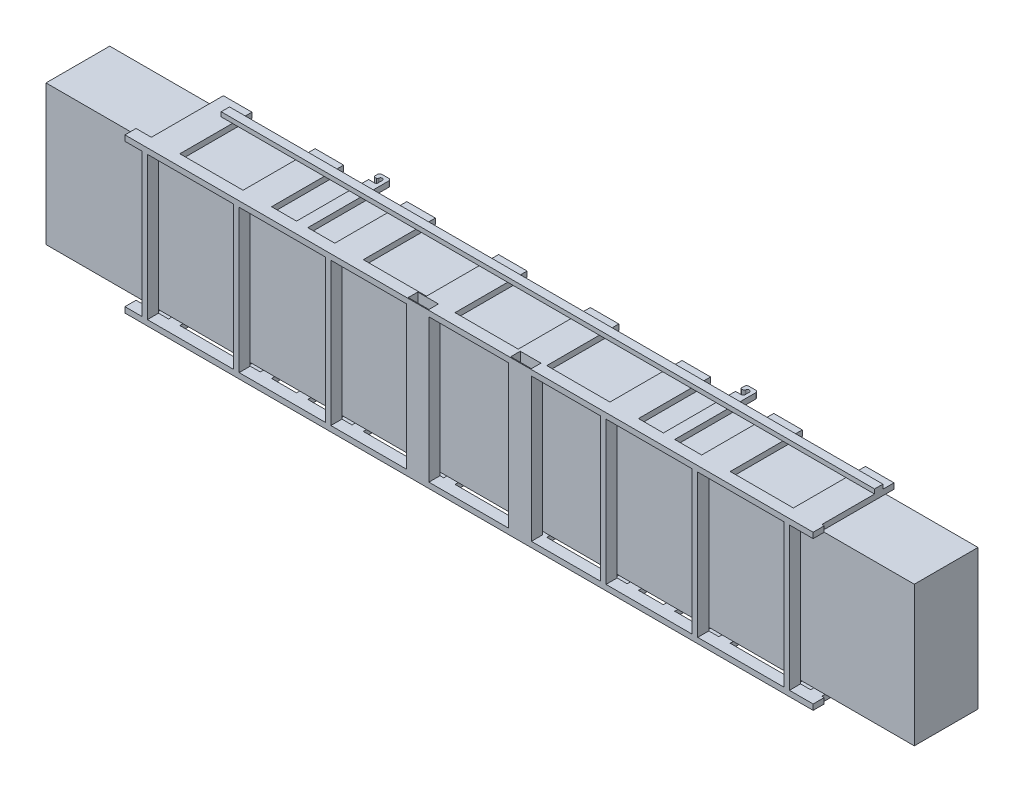
from build123d import *

# Parameters (mm, degrees)
SKETCH1_W             = 6190
SKETCH1_H             = 50
BOSS_EXTRUDE1_DEPTH   = 100
BOSS_EXTRUDE1_2_DEPTH = 100
SKETCH2_W             = 200
SKETCH2_H             = 100
BOSS_EXTRUDE2_DEPTH   = 1388
SKETCH3_W             = 186
SKETCH3_H             = 86
CUT_EXTRUDE1_DEPTH    = 6345.497143194
BOSS_EXTRUDE3_REACH   = 6335.746
SKETCH4_W             = 50
SKETCH4_H             = 100
SKETCH4_W_2           = 4
BOSS_EXTRUDE4_DEPTH   = 648.4
BOSS_EXTRUDE5_DEPTH   = 50
BOSS_EXTRUDE6_DEPTH   = 50
BOSS_EXTRUDE7_REACH   = 6369.355
SKETCH10_W            = 75
SKETCH10_H            = 40
SKETCH11_W            = 572.975396728
SKETCH11_H            = 1259.313187421
BOSS_EXTRUDE10_DEPTH  = 7000
SKETCH12_W            = 572.975396728
SKETCH12_H            = 1259.313187421
BOSS_EXTRUDE11_DEPTH  = 810


with BuildPart() as part:
    # Sketch1 → Boss-Extrude1 (new body)
    with BuildSketch(Plane.XY):
        with Locations((3095, 1363)):
            Rectangle(SKETCH1_W, SKETCH1_H)
    extrude(amount=BOSS_EXTRUDE1_DEPTH)



with BuildPart() as body_2:
    # Sketch1 → Boss-Extrude1 2 (new body)
    with BuildSketch(Plane.XY):
        with Locations((3095, 25)):
            Rectangle(SKETCH1_W, SKETCH1_H)
    extrude(amount=BOSS_EXTRUDE1_2_DEPTH)


with BuildPart() as part_1:
    add(part.part)

    add(body_2.part)  # Boss-Extrude2 merges body 2
    # Sketch2 → Boss-Extrude2 (add)
    with BuildSketch(Plane.XZ):
        with Locations((2634, 50)):
            Rectangle(SKETCH2_W, SKETCH2_H)
        with Locations((3556, 50)):
            Rectangle(SKETCH2_W, SKETCH2_H)
    extrude(amount=-BOSS_EXTRUDE2_DEPTH)

    # Sketch3 → Cut-Extrude1 (cut, through all)
    with BuildSketch(Plane(origin=(0, 1388, 0), x_dir=(1, 0, 0), z_dir=(0, 1, 0))):
        with Locations((2634, -50)):
            Rectangle(SKETCH3_W, SKETCH3_H)
        with Locations((3556, -50)):
            Rectangle(SKETCH3_W, SKETCH3_H)
    extrude(amount=-CUT_EXTRUDE1_DEPTH, mode=Mode.SUBTRACT)

    # Sketch4 → Boss-Extrude3 (add, up to next)
    with BuildSketch(Plane(origin=(0, 50, 0), x_dir=(1, 0, 0), z_dir=(0, 1, 0)), mode=Mode.PRIVATE) as boss_extrude3_sk1:
        with Locations((177, -50)):
            Rectangle(SKETCH4_W, SKETCH4_H)
    boss_extrude3_tool1 = extrude(boss_extrude3_sk1.sketch, amount=BOSS_EXTRUDE3_REACH, mode=Mode.PRIVATE) - part_1.part
    # Sketch4 → Boss-Extrude3 (add, up to next)
    with BuildSketch(Plane(origin=(0, 50, 0), x_dir=(1, 0, 0), z_dir=(0, 1, 0)), mode=Mode.PRIVATE) as boss_extrude3_sk2:
        with Locations((1002, -50)):
            Rectangle(SKETCH4_W, SKETCH4_H)
    boss_extrude3_tool2 = extrude(boss_extrude3_sk2.sketch, amount=BOSS_EXTRUDE3_REACH, mode=Mode.PRIVATE) - part_1.part
    # Sketch4 → Boss-Extrude3 (add, up to next)
    with BuildSketch(Plane(origin=(0, 50, 0), x_dir=(1, 0, 0), z_dir=(0, 1, 0)), mode=Mode.PRIVATE) as boss_extrude3_sk3:
        with Locations((1827, -50)):
            Rectangle(SKETCH4_W, SKETCH4_H)
    boss_extrude3_tool3 = extrude(boss_extrude3_sk3.sketch, amount=BOSS_EXTRUDE3_REACH, mode=Mode.PRIVATE) - part_1.part
    # Sketch4 → Boss-Extrude3 (add, up to next)
    with BuildSketch(Plane(origin=(0, 50, 0), x_dir=(1, 0, 0), z_dir=(0, 1, 0)), mode=Mode.PRIVATE) as boss_extrude3_sk4:
        with Locations((3454, -50)):
            Rectangle(SKETCH4_W_2, SKETCH4_H)
    boss_extrude3_tool4 = extrude(boss_extrude3_sk4.sketch, amount=BOSS_EXTRUDE3_REACH, mode=Mode.PRIVATE) - part_1.part
    # Sketch4 → Boss-Extrude3 (add, up to next)
    with BuildSketch(Plane(origin=(0, 50, 0), x_dir=(1, 0, 0), z_dir=(0, 1, 0)), mode=Mode.PRIVATE) as boss_extrude3_sk5:
        with Locations((4302, -50)):
            Rectangle(SKETCH4_W, SKETCH4_H)
    boss_extrude3_tool5 = extrude(boss_extrude3_sk5.sketch, amount=BOSS_EXTRUDE3_REACH, mode=Mode.PRIVATE) - part_1.part
    # Sketch4 → Boss-Extrude3 (add, up to next)
    with BuildSketch(Plane(origin=(0, 50, 0), x_dir=(1, 0, 0), z_dir=(0, 1, 0)), mode=Mode.PRIVATE) as boss_extrude3_sk6:
        with Locations((5127, -50)):
            Rectangle(SKETCH4_W, SKETCH4_H)
    boss_extrude3_tool6 = extrude(boss_extrude3_sk6.sketch, amount=BOSS_EXTRUDE3_REACH, mode=Mode.PRIVATE) - part_1.part
    # Sketch4 → Boss-Extrude3 (add, up to next)
    with BuildSketch(Plane(origin=(0, 50, 0), x_dir=(1, 0, 0), z_dir=(0, 1, 0)), mode=Mode.PRIVATE) as boss_extrude3_sk7:
        with Locations((5952, -50)):
            Rectangle(SKETCH4_W, SKETCH4_H)
    boss_extrude3_tool7 = extrude(boss_extrude3_sk7.sketch, amount=BOSS_EXTRUDE3_REACH, mode=Mode.PRIVATE) - part_1.part
    add(boss_extrude3_tool1.solids().sort_by_distance((177, 50, 50))[0])
    add(boss_extrude3_tool2.solids().sort_by_distance((1002, 50, 50))[0])
    add(boss_extrude3_tool3.solids().sort_by_distance((1827, 50, 50))[0])
    add(boss_extrude3_tool4.solids().sort_by_distance((3454, 50, 50))[0])
    add(boss_extrude3_tool5.solids().sort_by_distance((4302, 50, 50))[0])
    add(boss_extrude3_tool6.solids().sort_by_distance((5127, 50, 50))[0])
    add(boss_extrude3_tool7.solids().sort_by_distance((5952, 50, 50))[0])

    # Sketch5 → Boss-Extrude4 (add)
    with BuildSketch(Plane.XY):
        Polygon((137.4, 1388), (137.4, 1338), (140.4, 1338), (140.4, 1385.8), (292.4, 1385.8), (292.4, 1338), (394, 1338), (394, 1388), align=None)
        Polygon((962.4, 1388), (962.4, 1338), (965.4, 1338), (965.4, 1385.8), (1117.4, 1385.8), (1117.4, 1338), (1219, 1338), (1219, 1388), align=None)
        Polygon((1787.4, 1388), (1787.4, 1338), (1790.4, 1338), (1790.4, 1385.8), (1942.4, 1385.8), (1942.4, 1338), (2044, 1338), (2044, 1388), align=None)
        Polygon((2612.4, 1388), (2612.4, 1338), (2615.4, 1338), (2615.4, 1385.8), (2767.4, 1385.8), (2767.4, 1338), (2869, 1338), (2869, 1388), align=None)
        Polygon((3437.4, 1388), (3437.4, 1338), (3440.4, 1338), (3440.4, 1385.8), (3592.4, 1385.8), (3592.4, 1338), (3694, 1338), (3694, 1388), align=None)
        Polygon((4262.4, 1388), (4262.4, 1338), (4265.4, 1338), (4265.4, 1385.8), (4417.4, 1385.8), (4417.4, 1338), (4519, 1338), (4519, 1388), align=None)
        Polygon((5087.4, 1388), (5087.4, 1338), (5090.4, 1338), (5090.4, 1385.8), (5242.4, 1385.8), (5242.4, 1338), (5344, 1338), (5344, 1388), align=None)
        Polygon((5912.4, 1388), (5912.4, 1338), (5915.4, 1338), (5915.4, 1385.8), (6067.4, 1385.8), (6067.4, 1338), (6169, 1338), (6169, 1388), align=None)
        Polygon((6067.4, 2.2), (6067.4, 50), (6169, 50), (6169, 0), (5912.4, 0), (5912.4, 50), (5915.4, 50), (5915.4, 2.2), align=None)
        Polygon((5242.4, 2.2), (5242.4, 50), (5344, 50), (5344, 0), (5087.4, 0), (5087.4, 50), (5090.4, 50), (5090.4, 2.2), align=None)
        Polygon((4417.4, 2.2), (4417.4, 50), (4519, 50), (4519, 0), (4262.4, 0), (4262.4, 50), (4265.4, 50), (4265.4, 2.2), align=None)
        Polygon((3592.4, 2.2), (3592.4, 50), (3694, 50), (3694, 0), (3437.4, 0), (3437.4, 50), (3440.4, 50), (3440.4, 2.2), align=None)
        Polygon((2767.4, 2.2), (2767.4, 50), (2869, 50), (2869, 0), (2612.4, 0), (2612.4, 50), (2615.4, 50), (2615.4, 2.2), align=None)
        Polygon((1942.4, 2.2), (1942.4, 50), (2044, 50), (2044, 0), (1787.4, 0), (1787.4, 50), (1790.4, 50), (1790.4, 2.2), align=None)
        Polygon((1117.4, 2.2), (1117.4, 50), (1219, 50), (1219, 0), (962.4, 0), (962.4, 50), (965.4, 50), (965.4, 2.2), align=None)
        Polygon((292.4, 2.2), (292.4, 50), (394, 50), (394, 0), (137.4, 0), (137.4, 50), (140.4, 50), (140.4, 2.2), align=None)
    extrude(amount=-BOSS_EXTRUDE4_DEPTH)

    # Sketch8 → Boss-Extrude5 (add)
    with BuildSketch(Plane(origin=(0, 50, 0), x_dir=(1, 0, 0), z_dir=(0, 1, 0))):
        with BuildLine():
            Line((1443.4, 648.4), (1497.5, 648.4))
            ThreePointArc((1497.5, 648.4), (1508.106601718, 652.793398282), (1512.5, 663.4))
            Line((1512.5, 663.4), (1512.5, 703.4))
            ThreePointArc((1512.5, 703.4), (1495, 720.9), (1477.5, 703.4))
            ThreePointArc((1477.5, 703.4), (1474.571067812, 696.328932188), (1467.5, 693.4))
            Line((1467.5, 693.4), (1453.4, 693.4))
            ThreePointArc((1453.4, 693.4), (1446.328932188, 696.328932188), (1443.4, 703.4))
            Line((1443.4, 703.4), (1443.4, 728.4))
            ThreePointArc((1443.4, 728.4), (1449.257864376, 742.542135624), (1463.4, 748.4))
            Line((1463.4, 748.4), (1525, 748.4))
            ThreePointArc((1525, 748.4), (1539.142135624, 742.542135624), (1545, 728.4))
            Line((1545, 728.4), (1545, 0))
            Line((1545, 0), (1443.4, 0))
            Line((1443.4, 0), (1443.4, 648.4))
        make_face()
        with BuildLine():
            Line((4845, 0), (4743.4, 0))
            Line((4743.4, 0), (4743.4, 648.4))
            Line((4743.4, 648.4), (4797.5, 648.4))
            ThreePointArc((4797.5, 648.4), (4808.106601718, 652.793398282), (4812.5, 663.4))
            Line((4812.5, 663.4), (4812.5, 703.4))
            ThreePointArc((4812.5, 703.4), (4795, 720.9), (4777.5, 703.4))
            ThreePointArc((4777.5, 703.4), (4774.571067812, 696.328932188), (4767.5, 693.4))
            Line((4767.5, 693.4), (4753.4, 693.4))
            ThreePointArc((4753.4, 693.4), (4746.328932188, 696.328932188), (4743.4, 703.4))
            Line((4743.4, 703.4), (4743.4, 728.4))
            ThreePointArc((4743.4, 728.4), (4749.257864376, 742.542135624), (4763.4, 748.4))
            Line((4763.4, 748.4), (4825, 748.4))
            ThreePointArc((4825, 748.4), (4839.142135624, 742.542135624), (4845, 728.4))
            Line((4845, 728.4), (4845, 0))
        make_face()
    extrude(amount=-BOSS_EXTRUDE5_DEPTH)

    # Sketch9 → Boss-Extrude6 (add)
    with BuildSketch(Plane(origin=(0, 1388, 0), x_dir=(1, 0, 0), z_dir=(0, 1, 0))):
        with BuildLine():
            Line((1443.4, 648.4), (1497.5, 648.4))
            ThreePointArc((1497.5, 648.4), (1508.106601718, 652.793398282), (1512.5, 663.4))
            Line((1512.5, 663.4), (1512.5, 703.4))
            ThreePointArc((1512.5, 703.4), (1495, 720.9), (1477.5, 703.4))
            ThreePointArc((1477.5, 703.4), (1474.571067812, 696.328932188), (1467.5, 693.4))
            Line((1467.5, 693.4), (1453.4, 693.4))
            ThreePointArc((1453.4, 693.4), (1446.328932188, 696.328932188), (1443.4, 703.4))
            Line((1443.4, 703.4), (1443.4, 728.4))
            ThreePointArc((1443.4, 728.4), (1449.257864376, 742.542135624), (1463.4, 748.4))
            Line((1463.4, 748.4), (1525, 748.4))
            ThreePointArc((1525, 748.4), (1539.142135624, 742.542135624), (1545, 728.4))
            Line((1545, 728.4), (1545, 0))
            Line((1545, 0), (1443.4, 0))
            Line((1443.4, 0), (1443.4, 648.4))
        make_face()
        with BuildLine():
            Line((4845, 0), (4743.4, 0))
            Line((4743.4, 0), (4743.4, 648.4))
            Line((4743.4, 648.4), (4797.5, 648.4))
            ThreePointArc((4797.5, 648.4), (4808.106601718, 652.793398282), (4812.5, 663.4))
            Line((4812.5, 663.4), (4812.5, 703.4))
            ThreePointArc((4812.5, 703.4), (4795, 720.9), (4777.5, 703.4))
            ThreePointArc((4777.5, 703.4), (4774.571067812, 696.328932188), (4767.5, 693.4))
            Line((4767.5, 693.4), (4753.4, 693.4))
            ThreePointArc((4753.4, 693.4), (4746.328932188, 696.328932188), (4743.4, 703.4))
            Line((4743.4, 703.4), (4743.4, 728.4))
            ThreePointArc((4743.4, 728.4), (4749.257864376, 742.542135624), (4763.4, 748.4))
            Line((4763.4, 748.4), (4825, 748.4))
            ThreePointArc((4825, 748.4), (4839.142135624, 742.542135624), (4845, 728.4))
            Line((4845, 728.4), (4845, 0))
        make_face()
    extrude(amount=-BOSS_EXTRUDE6_DEPTH)

    # Boss-Extrude7: up to this face of the body (flat: up to its plane)
    boss_extrude7_end = Plane(part_1.part.faces().sort_by_distance((292.4, 1361.9, -324.2))[0])
    # Sketch10 → Boss-Extrude7 (add, up to the picked face)
    with BuildSketch(Plane(origin=(6169, 0, 0), x_dir=(0, 0, -1), z_dir=(1, 0, 0)), mode=Mode.PRIVATE) as boss_extrude7_sk1:
        with Locations((510.9, -20)):
            Rectangle(SKETCH10_W, SKETCH10_H)
    boss_extrude7_tool1 = split(extrude(boss_extrude7_sk1.sketch, amount=-BOSS_EXTRUDE7_REACH, mode=Mode.PRIVATE), bisect_by=boss_extrude7_end, keep=Keep.BOTH, mode=Mode.PRIVATE)
    # Sketch10 → Boss-Extrude7 (add, up to the picked face)
    with BuildSketch(Plane(origin=(6169, 0, 0), x_dir=(0, 0, -1), z_dir=(1, 0, 0)), mode=Mode.PRIVATE) as boss_extrude7_sk2:
        with Locations((510.9, 1408)):
            Rectangle(SKETCH10_W, SKETCH10_H)
    boss_extrude7_tool2 = split(extrude(boss_extrude7_sk2.sketch, amount=-BOSS_EXTRUDE7_REACH, mode=Mode.PRIVATE), bisect_by=boss_extrude7_end, keep=Keep.BOTH, mode=Mode.PRIVATE)
    add(boss_extrude7_tool1.solids().sort_by(Axis((6169, -20, -510.9), (-1, 0, 0)))[0])
    add(boss_extrude7_tool2.solids().sort_by(Axis((6169, 1408, -510.9), (-1, 0, 0)))[0])


with BuildPart() as body_2_2:
    # Sketch11 → Boss-Extrude10 (new body)
    with BuildSketch(Plane(origin=(0, 0, 0), x_dir=(0, 0, -1), z_dir=(1, 0, 0))):
        with Locations((286.487698364, 708.343406289)):
            Rectangle(SKETCH11_W, SKETCH11_H)
    extrude(amount=BOSS_EXTRUDE10_DEPTH)

    # Sketch12 → Boss-Extrude11 (add)
    with BuildSketch(Plane.ZY):
        with Locations((-286.487698364, 708.343406289)):
            Rectangle(SKETCH12_W, SKETCH12_H)
    extrude(amount=BOSS_EXTRUDE11_DEPTH)


solid = Compound([part_1.part, body_2_2.part])
